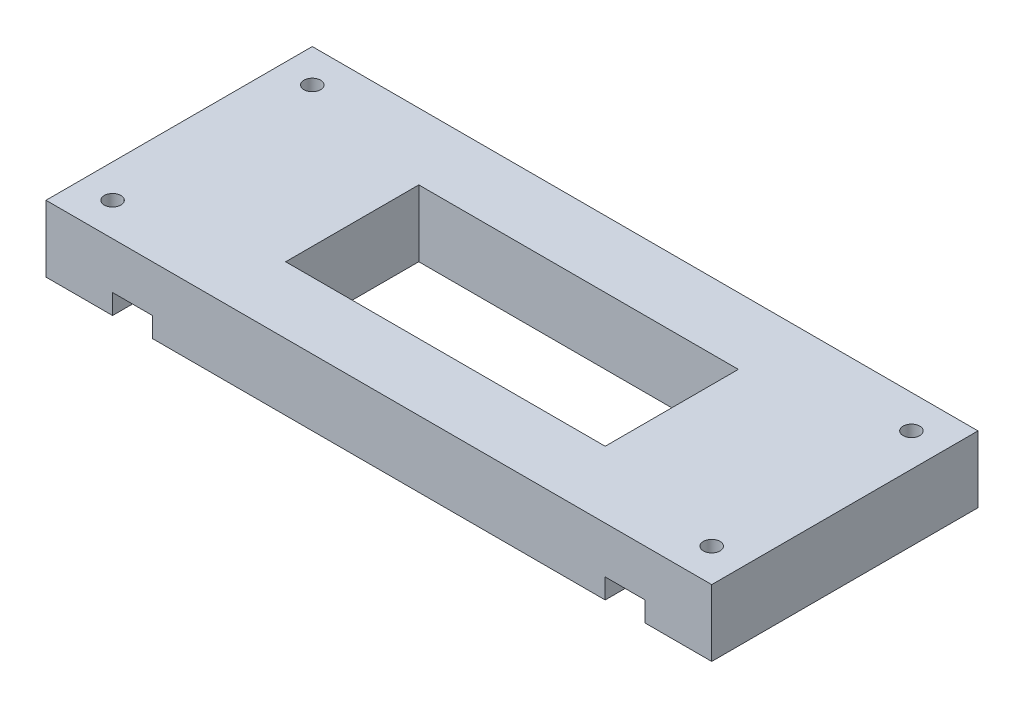
from build123d import *

# Parameters (mm, degrees)
BOSS_EXTRU_1_DEPTH      = 40
ENL_V_MAT_EXTRU_1_REACH = 110.167
ESQUISSE2_W             = 48
ESQUISSE2_H             = 20
ENL_V_MAT_EXTRU_2_REACH = 110.167
ESQUISSE3_R             = 1.25


with BuildPart() as part:
    # Esquisse1 → Boss.-Extru.1 (new body)
    with BuildSketch(Plane.XY):
        Polygon((0, 0), (10, 0), (10, 3), (16, 3), (16, 0), (84, 0), (84, 3), (90, 3), (90, 0), (100, 0), (100, 10), (0, 10), align=None)
    extrude(amount=BOSS_EXTRU_1_DEPTH)

    # Esquisse2 → Enlèv. mat.-Extru.1 (cut, up to next)
    with BuildSketch(Plane(origin=(0, 10, 0), x_dir=(1, 0, 0), z_dir=(0, 1, 0)), mode=Mode.PRIVATE) as enl_v_mat_extru_1_sk1:
        with Locations((50, -20)):
            Rectangle(ESQUISSE2_W, ESQUISSE2_H)
    enl_v_mat_extru_1_tool1 = extrude(enl_v_mat_extru_1_sk1.sketch, amount=-ENL_V_MAT_EXTRU_1_REACH, mode=Mode.PRIVATE) & part.part
    add(enl_v_mat_extru_1_tool1.solids().sort_by_distance((50, 10, 20))[0], mode=Mode.SUBTRACT)

    # Esquisse3 → Enlèv. mat.-Extru.2 (cut, up to next)
    with BuildSketch(Plane.XZ, mode=Mode.PRIVATE) as enl_v_mat_extru_2_sk1:
        with Locations(Location((5, 35, 0), (0, 0, 270))):
            Circle(ESQUISSE3_R)
    enl_v_mat_extru_2_tool1 = extrude(enl_v_mat_extru_2_sk1.sketch, amount=-ENL_V_MAT_EXTRU_2_REACH, mode=Mode.PRIVATE) & part.part
    # Esquisse3 → Enlèv. mat.-Extru.2 (cut, up to next)
    with BuildSketch(Plane.XZ, mode=Mode.PRIVATE) as enl_v_mat_extru_2_sk2:
        with Locations(Location((5, 5, 0), (0, 0, 270))):
            Circle(ESQUISSE3_R)
    enl_v_mat_extru_2_tool2 = extrude(enl_v_mat_extru_2_sk2.sketch, amount=-ENL_V_MAT_EXTRU_2_REACH, mode=Mode.PRIVATE) & part.part
    # Esquisse3 → Enlèv. mat.-Extru.2 (cut, up to next)
    with BuildSketch(Plane.XZ, mode=Mode.PRIVATE) as enl_v_mat_extru_2_sk3:
        with Locations(Location((95, 35, 0), (0, 0, 270))):
            Circle(ESQUISSE3_R)
    enl_v_mat_extru_2_tool3 = extrude(enl_v_mat_extru_2_sk3.sketch, amount=-ENL_V_MAT_EXTRU_2_REACH, mode=Mode.PRIVATE) & part.part
    # Esquisse3 → Enlèv. mat.-Extru.2 (cut, up to next)
    with BuildSketch(Plane.XZ, mode=Mode.PRIVATE) as enl_v_mat_extru_2_sk4:
        with Locations(Location((95, 5, 0), (0, 0, 270))):
            Circle(ESQUISSE3_R)
    enl_v_mat_extru_2_tool4 = extrude(enl_v_mat_extru_2_sk4.sketch, amount=-ENL_V_MAT_EXTRU_2_REACH, mode=Mode.PRIVATE) & part.part
    add(enl_v_mat_extru_2_tool1.solids().sort_by_distance((5, 0, 35))[0], mode=Mode.SUBTRACT)
    add(enl_v_mat_extru_2_tool2.solids().sort_by_distance((5, 0, 5))[0], mode=Mode.SUBTRACT)
    add(enl_v_mat_extru_2_tool3.solids().sort_by_distance((95, 0, 35))[0], mode=Mode.SUBTRACT)
    add(enl_v_mat_extru_2_tool4.solids().sort_by_distance((95, 0, 5))[0], mode=Mode.SUBTRACT)


solid = part.part
